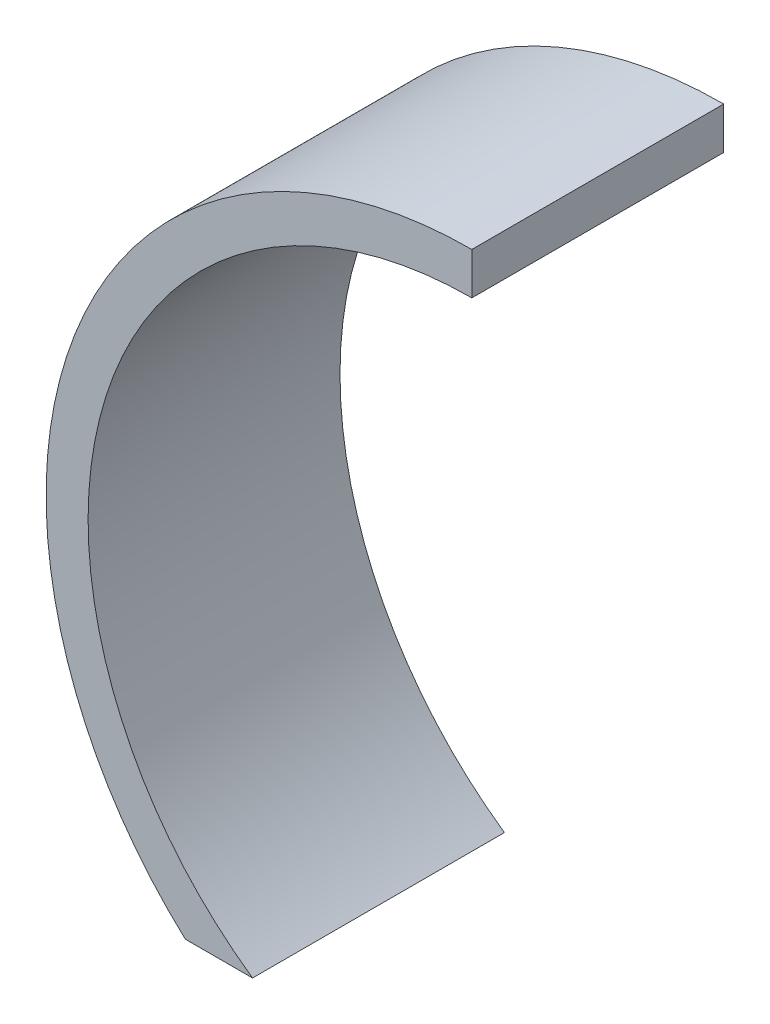
from build123d import *

# Parameters (mm, degrees)
BOSS_EXTRUDE1_DEPTH = 38.1
CUT_EXTRUDE1_DEPTH  = 99.710456386


with BuildPart() as part:
    # Sketch1 → Boss-Extrude1 (new body)
    with BuildSketch(Plane.XY):
        with BuildLine():
            Line((0, 58.04), (0, 64.39))
            ThreePointArc((0, 64.39), (-61.434212481, 19.284958823), (-36.7993868, -52.838217524))
            Line((-36.7993868, -52.838217524), (-33.170312314, -47.627428872))
            ThreePointArc((-33.170312314, -47.627428872), (-55.375705737, 17.383118654), (0, 58.04))
        make_face()
    extrude(amount=-BOSS_EXTRUDE1_DEPTH)

    # Sketch2 → Cut-Extrude1 (cut, through all)
    with BuildSketch(Plane.XY):
        with BuildLine():
            Line((-36.7993868, -52.838217524), (-33.170312314, -47.627428872))
            Line((-33.170312314, -47.627428872), (-43.332437261, -47.627428872))
            ThreePointArc((-43.332437261, -47.627428872), (-40.150534074, -50.338918478), (-36.7993868, -52.838217524))
        make_face()
    extrude(amount=-CUT_EXTRUDE1_DEPTH, mode=Mode.SUBTRACT)


solid = part.part
